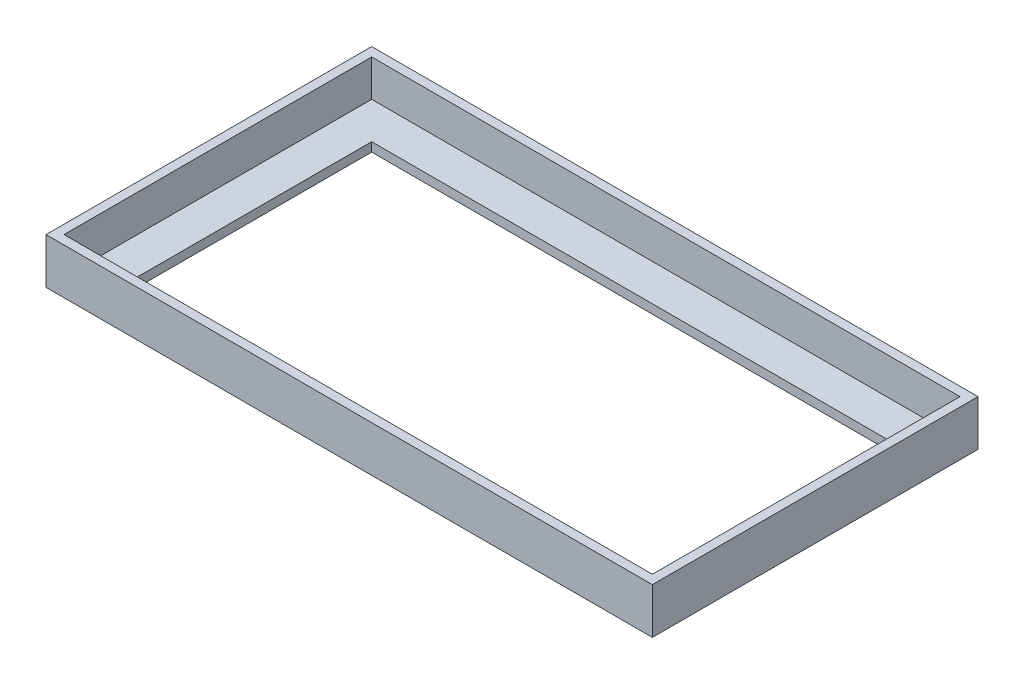
from build123d import *

# Parameters (mm, degrees)
SKETCH1_W           = 337
SKETCH1_H           = 181
BOSS_EXTRUDE1_DEPTH = 25.4
SHELL1_T            = -5
SKETCH2_W           = 286.2
SKETCH2_H           = 130.2
CUT_EXTRUDE1_DEPTH  = 193.944707105


with BuildPart() as part:
    # Sketch1 → Boss-Extrude1 (new body)
    with BuildSketch(Plane(origin=(0, 0, 0), x_dir=(1, 0, 0), z_dir=(0, 1, 0))):
        Rectangle(SKETCH1_W, SKETCH1_H)
    extrude(amount=BOSS_EXTRUDE1_DEPTH)

    # Shell1
    shell1_openings = [part.faces().sort_by_distance(p)[0] for p in [
        (0, 25.4, 0),
    ]]
    offset(amount=SHELL1_T, openings=shell1_openings, kind=Kind.INTERSECTION)

    # Sketch2 → Cut-Extrude1 (cut, through all)
    with BuildSketch(Plane.XZ):
        Rectangle(SKETCH2_W, SKETCH2_H)
    extrude(amount=-CUT_EXTRUDE1_DEPTH, mode=Mode.SUBTRACT)


solid = part.part
